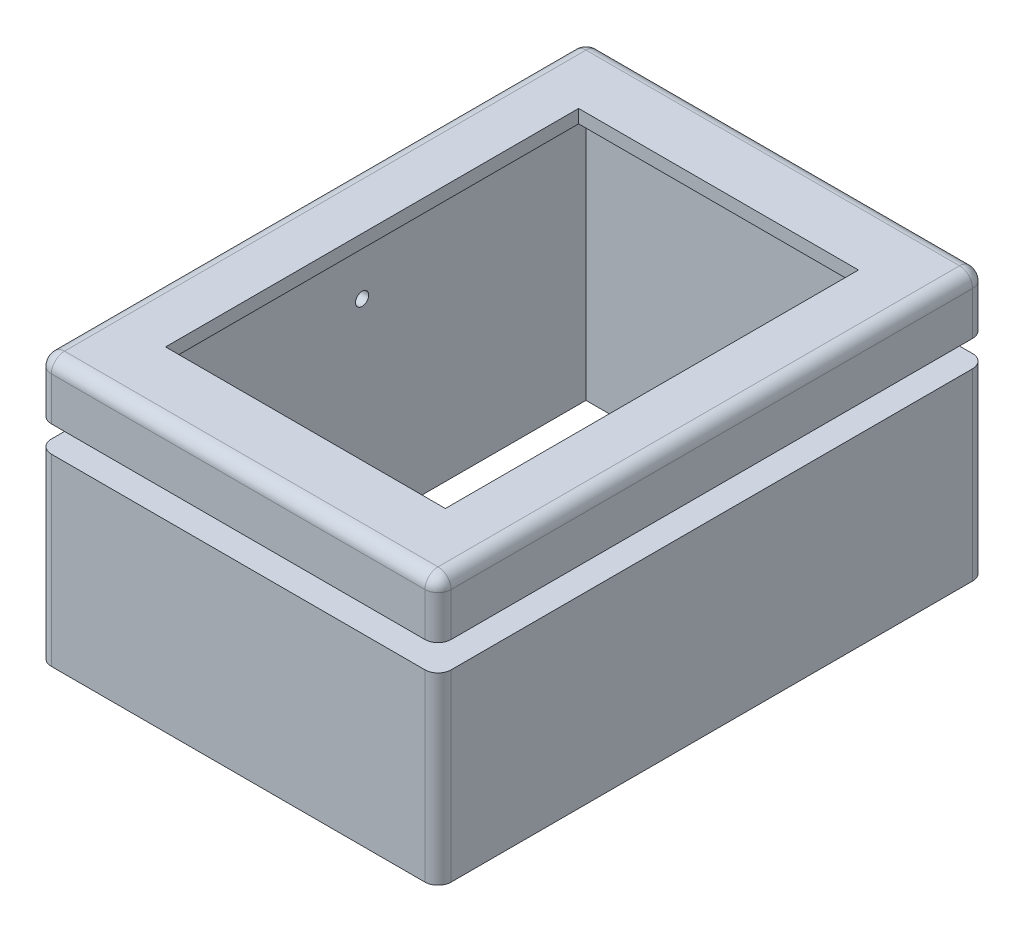
from build123d import *

# Parameters (mm, degrees)
SKETCH1_W           = 15.24
SKETCH1_H           = 20.8788
SKETCH1_W_2         = 10.668
SKETCH1_H_2         = 15.748
BOSS_EXTRUDE1_DEPTH = 10.16
SKETCH2_R           = 0.25
CUT_EXTRUDE1_DEPTH  = 28.774223471
SKETCH3_W           = 11.43
SKETCH3_H           = 17.0688
CUT_EXTRUDE2_DEPTH  = 9.652
SKETCH5_W           = 15.24
SKETCH5_H           = 20.8788
SKETCH5_W_2         = 12.24
SKETCH5_H_2         = 17.8788
CUT_EXTRUDE4_DEPTH  = 1
FILLET1_R           = 0.5


with BuildPart() as part:
    # Sketch1 → Boss-Extrude1 (new body)
    with BuildSketch(Plane(origin=(0, 0, 0), x_dir=(1, 0, 0), z_dir=(0, 1, 0))):
        with Locations((7.62, 10.4394)):
            Rectangle(SKETCH1_W, SKETCH1_H)
        with Locations((7.62, 10.4394)):
            Rectangle(SKETCH1_W_2, SKETCH1_H_2, mode=Mode.SUBTRACT)
    extrude(amount=BOSS_EXTRUDE1_DEPTH)

    # Sketch2 → Cut-Extrude1 (cut, through all)
    with BuildSketch(Plane(origin=(15.24, 0, 0), x_dir=(0, 0, -1), z_dir=(1, 0, 0))):
        with Locations((10.4394, 7.62)):
            Circle(SKETCH2_R)
    extrude(amount=-CUT_EXTRUDE1_DEPTH, mode=Mode.SUBTRACT)

    # Sketch3 → Cut-Extrude2 (cut)
    with BuildSketch(Plane.XZ):
        with Locations((7.62, -10.4394)):
            Rectangle(SKETCH3_W, SKETCH3_H)
    extrude(amount=-CUT_EXTRUDE2_DEPTH, mode=Mode.SUBTRACT)

    # Sketch5 → Cut-Extrude4 (cut)
    with BuildSketch(Plane(origin=(0, 8.01, 0), x_dir=(1, 0, 0), z_dir=(0, 1, 0))):
        with Locations((7.62, 10.4394)):
            Rectangle(SKETCH5_W, SKETCH5_H)
        with Locations((7.62, 10.4394)):
            Rectangle(SKETCH5_W_2, SKETCH5_H_2, mode=Mode.SUBTRACT)
    extrude(amount=-CUT_EXTRUDE4_DEPTH, mode=Mode.SUBTRACT)

    # Fillet1
    fillet1_edges = [part.edges().sort_by_distance(p)[0] for p in [
        (15.24, 10.16, -10.4394),
        (7.62, 10.16, -20.8788),
        (0, 10.16, -10.4394),
        (0, 3.505, -20.8788),
        (15.24, 3.505, -20.8788),
        (15.24, 3.505, 0),
        (0, 3.505, 0),
        (7.62, 10.16, 0),
        (0, 9.085, -20.8788),
        (15.24, 9.085, -20.8788),
        (15.24, 9.085, 0),
        (0, 9.085, 0),
    ]]
    fillet(fillet1_edges, radius=FILLET1_R)


solid = part.part
